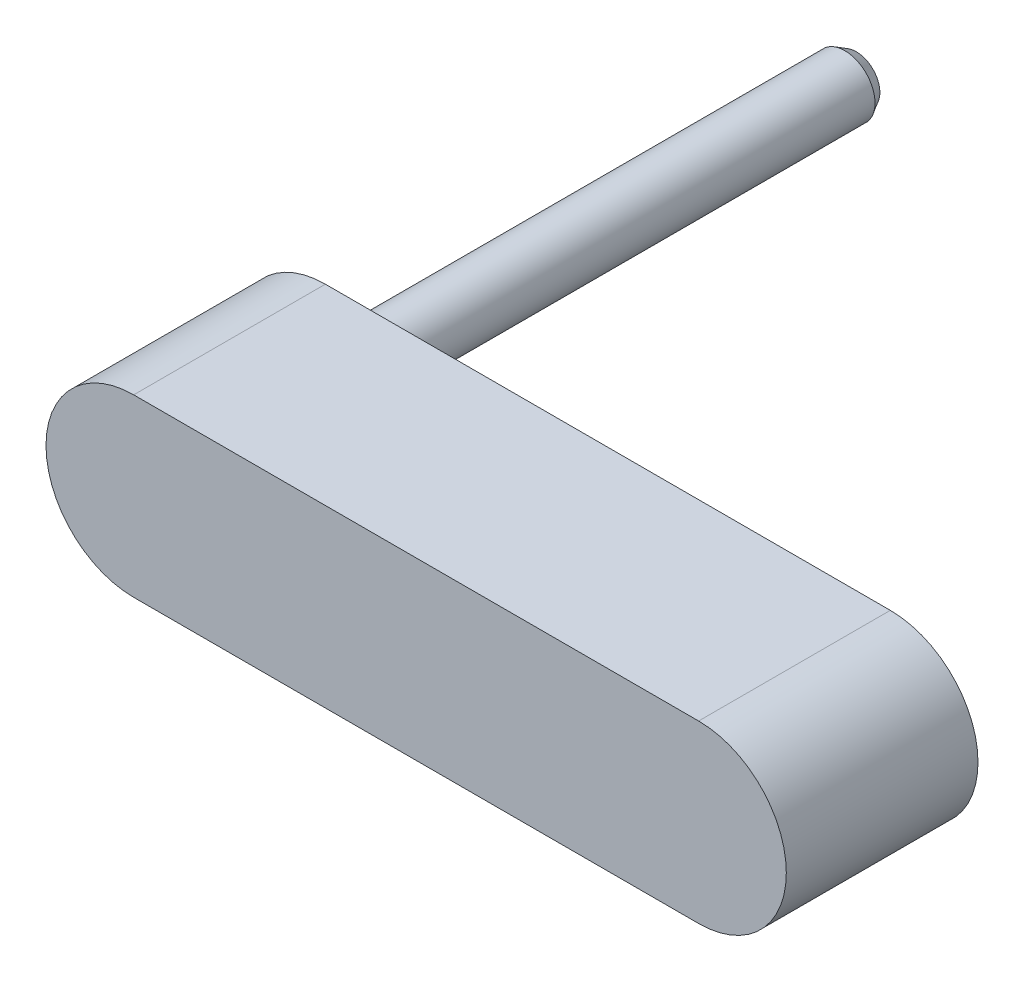
from build123d import *

# Parameters (mm, degrees)
SALIENTE_EXTRUIR1_DEPTH = 20
SALIENTE_EXTRUIR2_DEPTH = 20
CROQUIS3_R              = 3.15
SALIENTE_EXTRUIR3_DEPTH = 55.4
CHAFL_N1_SIZE           = 1.2
CHAFL_N1_SIZE2          = 0.692820323


with BuildPart() as part:
    # Croquis1 → Saliente-Extruir1 (new body)
    with BuildSketch(Plane.XY):
        with BuildLine():
            Line((63.919718915, 2.991646678), (0.57794053, 7.728420585))
            ThreePointArc((0.57794053, 7.728420585), (-7.75, 0), (0.57794053, -7.728420585))
            Line((0.57794053, -7.728420585), (63.919718915, -2.991646678))
            ThreePointArc((63.919718915, -2.991646678), (66.696, 0), (63.919718915, 2.991646678))
        make_face()
    extrude(amount=SALIENTE_EXTRUIR1_DEPTH)

    # Croquis2 → Saliente-Extruir2 (add)
    with BuildSketch(Plane.XY):
        with BuildLine():
            Line((0, 9.15), (58.946, 9.15))
            ThreePointArc((58.946, 9.15), (68.096, 0), (58.946, -9.15))
            Line((58.946, -9.15), (0, -9.15))
            ThreePointArc((0, -9.15), (-9.15, 0), (0, 9.15))
        make_face()
    extrude(amount=SALIENTE_EXTRUIR2_DEPTH)

    # Croquis3 → Saliente-Extruir3 (add)
    with BuildSketch(Plane(origin=(0, 0, 0), x_dir=(-1, 0, 0), z_dir=(0, 0, -1))):
        Circle(CROQUIS3_R)
    extrude(amount=SALIENTE_EXTRUIR3_DEPTH)

    # Chaflán1
    chafl_n1_edges = [part.edges().sort_by_distance(p)[0] for p in [
        (3.15, 0, -55.4),
    ]]
    chafl_n1_side = [part.faces().sort_by_distance(p)[0] for p in [
        (3.15, 0, -27.7),
    ]]
    chamfer(chafl_n1_edges, length=CHAFL_N1_SIZE, length2=CHAFL_N1_SIZE2, reference=chafl_n1_side[0])


solid = part.part
